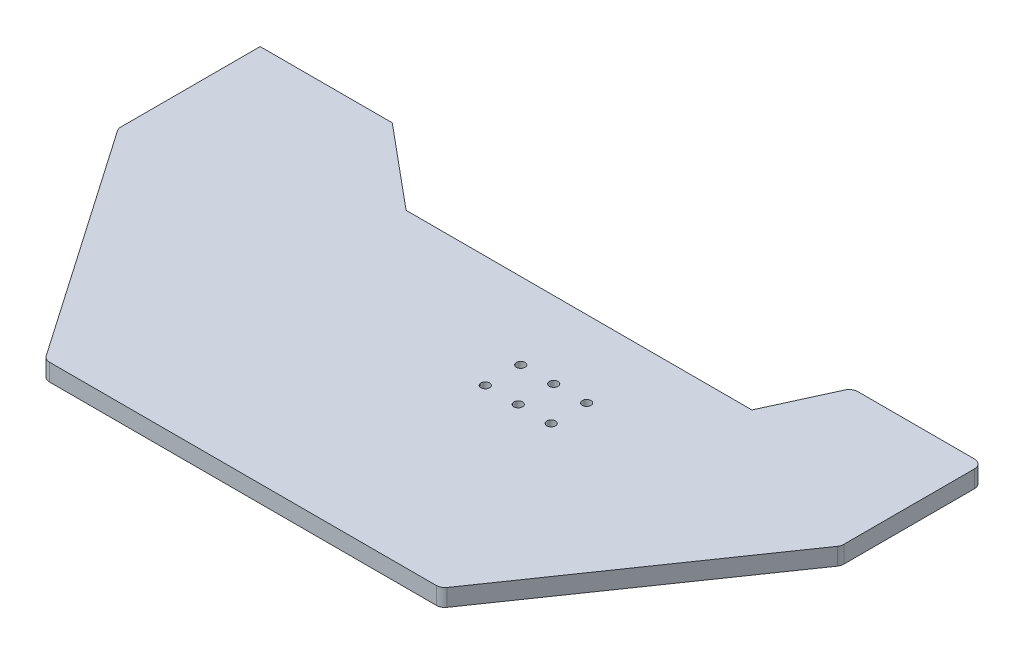
from build123d import *

# Parameters (mm, degrees)
BOSS_EXTRUDE1_DEPTH = 6.35
SKETCH2_R           = 3.175
CUT_EXTRUDE1_DEPTH  = 302.34078715
CUT_EXTRUDE2_DEPTH  = 302.34078715
FILLET1_R           = 6.35


with BuildPart() as part:
    # Sketch1 → Boss-Extrude1 (new, symmetric)
    with BuildSketch(Plane(origin=(0, 0, 0), x_dir=(1, 0, 0), z_dir=(0, 1, 0))):
        Polygon((-266.7, -139.7), (266.7, -139.7), (266.7, 139.7), (170.18, 139.7), (146.939, 88.9), (-108.237741638, 88.9), (-169.2275, 139.7), (-266.7, 139.7), align=None)
    extrude(amount=BOSS_EXTRUDE1_DEPTH, both=True)

    # Sketch2 → Cut-Extrude1 (cut, through all)
    with BuildSketch(Plane(origin=(0, 6.35, 0), x_dir=(1, 0, 0), z_dir=(0, 1, 0))):
        with Locations(Location((81.4832, 6.2484, 0), (0, 0, 270))):
            Circle(SKETCH2_R)
        with Locations(Location((81.4832, 32.4104, 0), (0, 0, 270))):
            Circle(SKETCH2_R)
        with Locations(Location((57.1627, 32.4104, 0), (0, 0, 270))):
            Circle(SKETCH2_R)
        with Locations(Location((32.8422, 32.4104, 0), (0, 0, 270))):
            Circle(SKETCH2_R)
        with Locations(Location((32.8422, 6.2484, 0), (0, 0, 270))):
            Circle(SKETCH2_R)
        with Locations(Location((57.1627, 6.2484, 0), (0, 0, 270))):
            Circle(SKETCH2_R)
    extrude(amount=-CUT_EXTRUDE1_DEPTH, mode=Mode.SUBTRACT)

    # Sketch3 → Cut-Extrude2 (cut, through all)
    with BuildSketch(Plane(origin=(0, 6.35, 0), x_dir=(1, 0, 0), z_dir=(0, 1, 0))):
        Polygon((-266.7, 34.925), (-146.05, -139.7), (-266.7, -139.7), align=None)
    cut_extrude2 = extrude(amount=-CUT_EXTRUDE2_DEPTH, mode=Mode.SUBTRACT)

    # Mirror1: Cut-Extrude2 across plane
    add(cut_extrude2.mirror(Plane(origin=(0, 0, 0), x_dir=(0, 0, 1), z_dir=(1, 0, 0))), mode=Mode.SUBTRACT)

    # Fillet1
    fillet1_edges = [part.edges().sort_by_distance(p)[0] for p in [
        (170.18, 0, -139.7),
        (266.7, 0, -139.7),
        (-266.7, 0, -34.925),
        (-146.05, 0, 139.7),
        (266.7, 0, -34.925),
        (146.05, 0, 139.7),
    ]]
    fillet(fillet1_edges, radius=FILLET1_R)


solid = part.part
